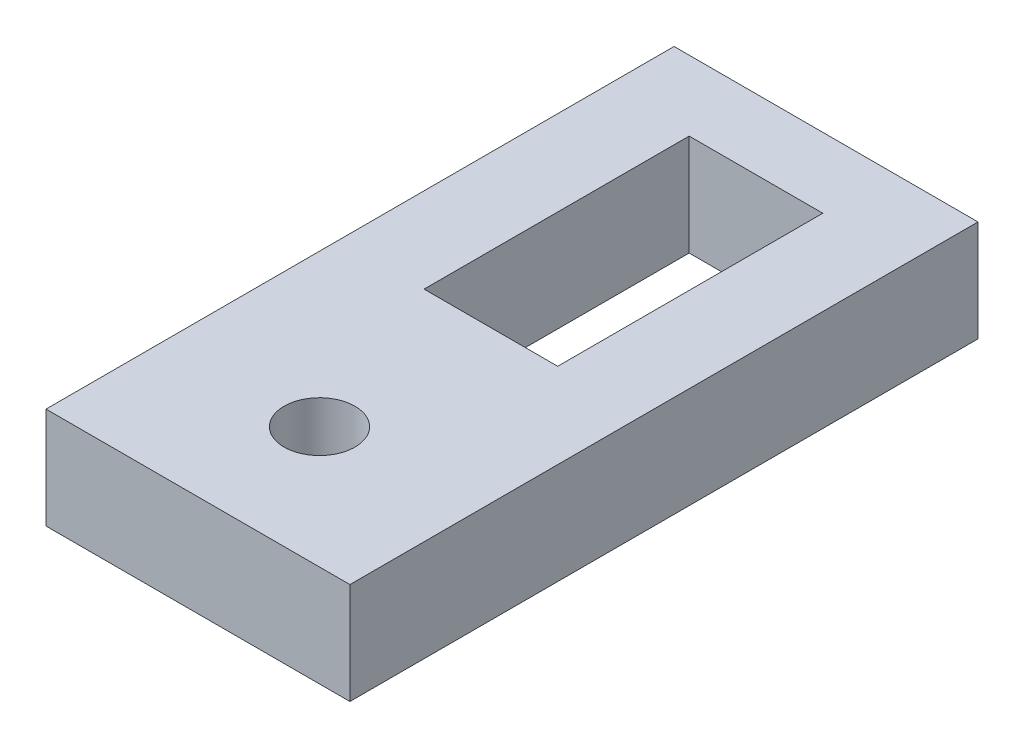
from build123d import *

# Parameters (mm, degrees)
SKETCH_1_W          = 62
SKETCH_1_H          = 10
EXTRUDE_1_DEPTH     = 15
SKETCH_2_R          = 6.5
CUT_EXTRUDE_1_DEPTH = 5
SKETCH_4_R          = 3.5
CUT_EXTRUDE_3_DEPTH = 53.440442409
SKETCH_3_W          = 13.191362224
SKETCH_3_H          = 26.166472608
CUT_EXTRUDE_2_DEPTH = 54.150729064


with BuildPart() as part:
    # 草图1 → 凸台-拉伸1 (new, symmetric)
    with BuildSketch(Plane(origin=(0, 0, 0), x_dir=(0, 0, -1), z_dir=(1, 0, 0))):
        with Locations((19, 0)):
            Rectangle(SKETCH_1_W, SKETCH_1_H)
    extrude(amount=EXTRUDE_1_DEPTH, both=True)

    # 草图2 → 切除-拉伸1 (cut)
    with BuildSketch(Plane(origin=(0, -5, 0), x_dir=(1, 0, 0), z_dir=(0, 1, 0))):
        with Locations(Location((0, 0, 0), (0, 0, 270))):
            Circle(SKETCH_2_R)
    extrude(amount=CUT_EXTRUDE_1_DEPTH, mode=Mode.SUBTRACT)

    # 草图4 → 切除-拉伸3 (cut, through all)
    with BuildSketch(Plane.XZ):
        with Locations(Location((0, 0, 0), (0, 0, 270))):
            Circle(SKETCH_4_R)
    extrude(amount=-CUT_EXTRUDE_3_DEPTH, mode=Mode.SUBTRACT)

    # 草图3 → 切除-拉伸2 (cut, through all)
    with BuildSketch(Plane(origin=(0, 5, 0), x_dir=(1, 0, 0), z_dir=(0, 1, 0))):
        with Locations((0, 30)):
            Rectangle(SKETCH_3_W, SKETCH_3_H)
    extrude(amount=-CUT_EXTRUDE_2_DEPTH, mode=Mode.SUBTRACT)


solid = part.part
